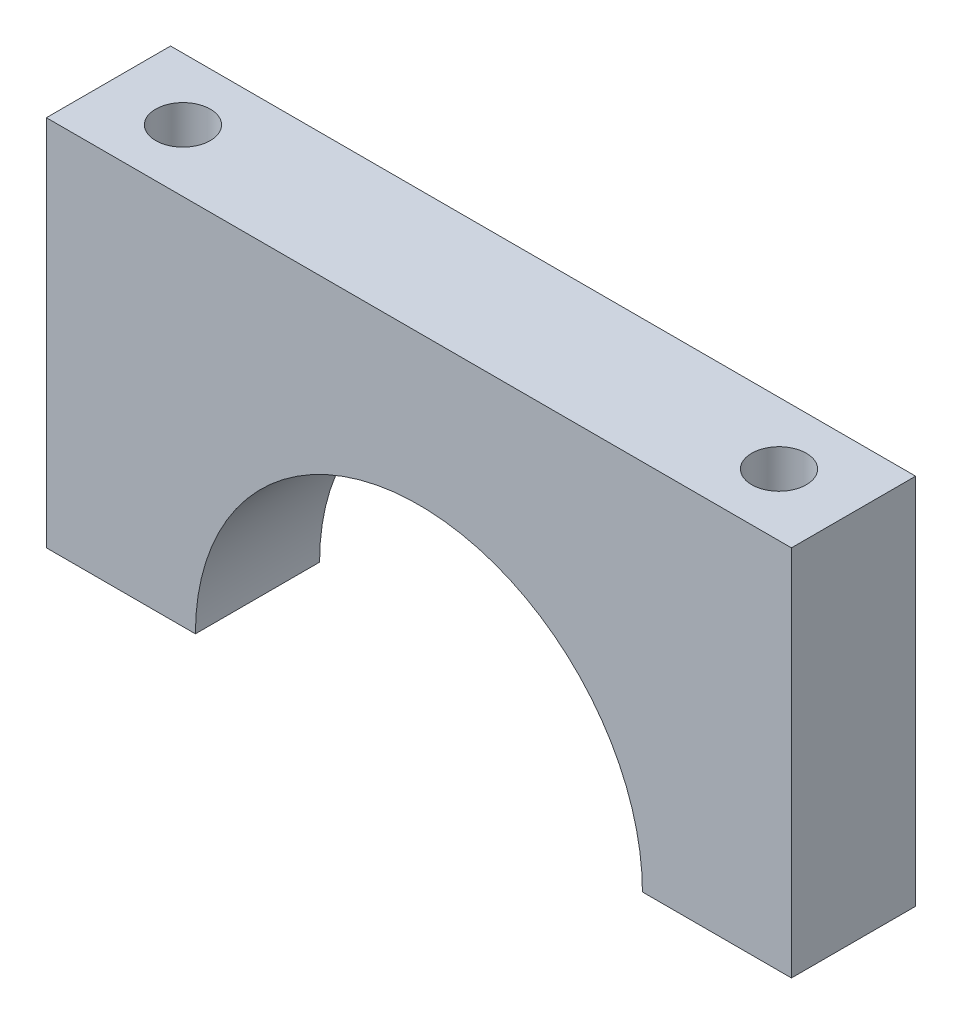
from build123d import *

# Parameters (mm, degrees)
BOSS_EXTRUDE1_DEPTH     = 5
CUT_EXTRUDE1_DEPTH      = 22.794494718
CUT_EXTRUDE1_DEPTH_BACK = 22.794494718
SKETCH2_R               = 1.1


with BuildPart() as part:
    # Sketch1 → Boss-Extrude1 (new body)
    with BuildSketch(Plane.XY):
        with BuildLine():
            Line((-15, 0), (-9, 0))
            ThreePointArc((-9, 0), (0, 9), (9, 0))
            Line((9, 0), (15, 0))
            Line((15, 0), (15, 15))
            Line((15, 15), (-15, 15))
            Line((-15, 15), (-15, 0))
        make_face()
    extrude(amount=BOSS_EXTRUDE1_DEPTH)

    # Sketch2 → Cut-Extrude1 (cut, two sides: drawn at the far end of the back side and taken through both)
    with BuildSketch(Plane(origin=(0, 15, 0), x_dir=(1, 0, 0), z_dir=(0, 1, 0)).offset(-CUT_EXTRUDE1_DEPTH_BACK)):
        with Locations(Location((-12, -2.5, 0), (0, 0, 180))):
            Circle(SKETCH2_R)
        with Locations(Location((12, -2.5, 0), (0, 0, 180))):
            Circle(SKETCH2_R)
    extrude(amount=CUT_EXTRUDE1_DEPTH + CUT_EXTRUDE1_DEPTH_BACK, mode=Mode.SUBTRACT)


solid = part.part
